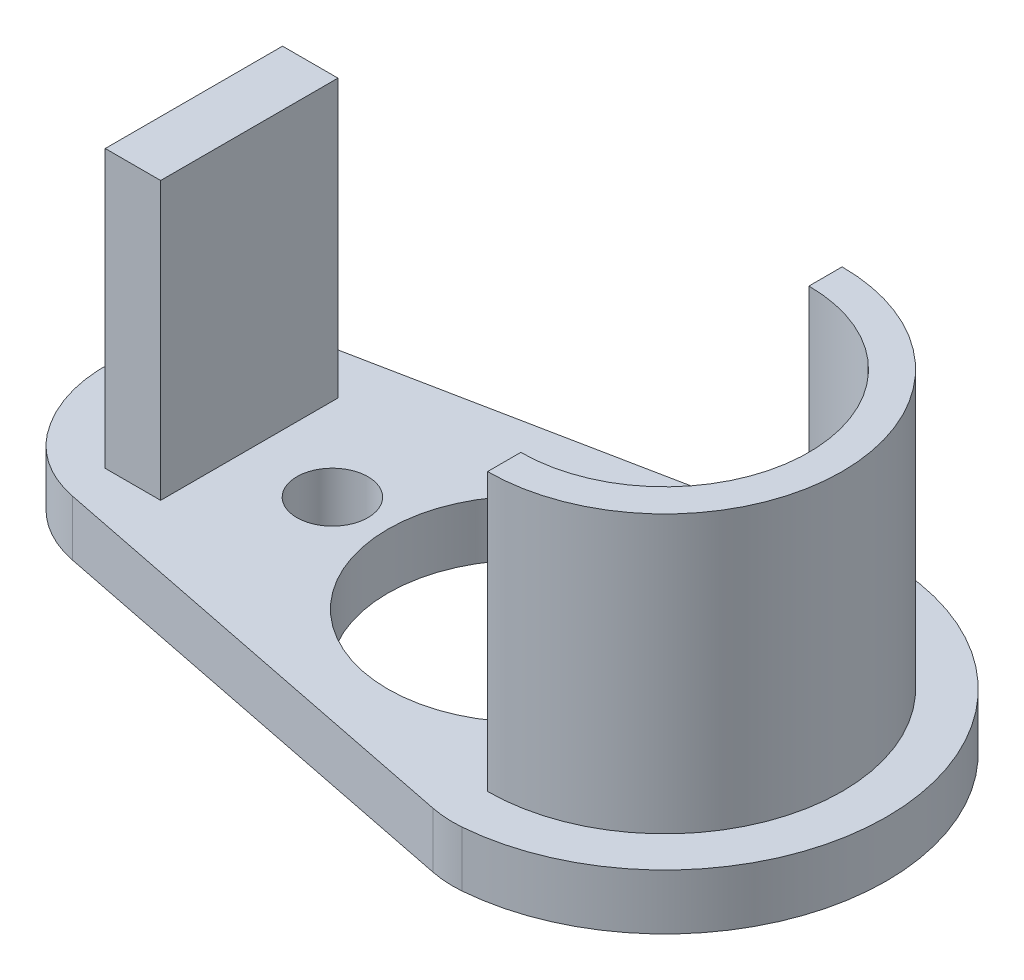
from build123d import *

# Parameters (mm, degrees)
SKETCH1_R           = 1.25
SKETCH1_R_2         = 0.3207
BOSS_EXTRUDE1_DEPTH = 0.5
SKETCH1_24_W        = 0.5
SKETCH1_24_H        = 1.6
BOSS_EXTRUDE2_DEPTH = 3


with BuildPart() as part:
    # Sketch1 → Boss-Extrude1 (new body)
    with BuildSketch(Plane(origin=(0, 0, 0), x_dir=(1, 0, 0), z_dir=(0, 1, 0))):
        with BuildLine():
            ThreePointArc((0.1641009, 1.993256355), (0.024548565, 1.994973575), (-0.113883759, 1.977245221))
            Line((-0.113883759, 1.977245221), (-4.183235691, 1.164159973))
            ThreePointArc((-4.183235691, 1.164159973), (-4.514100231, 1.033532975), (-4.77830642, 0.795352694))
            ThreePointArc((-4.77830642, 0.795352694), (-5.05, 0), (-4.77830642, -0.795352694))
            ThreePointArc((-4.77830642, -0.795352694), (-4.514100231, -1.033532975), (-4.183235691, -1.164159973))
            Line((-4.183235691, -1.164159973), (-0.11388376, -1.977245221))
            ThreePointArc((-0.11388376, -1.977245221), (0.024548564, -1.994973575), (0.164100898, -1.993256355))
            ThreePointArc((0.164100898, -1.993256355), (2, -1e-09), (0.1641009, 1.993256355))
        make_face()
        with Locations((-1.25, 0)):
            Circle(SKETCH1_R, mode=Mode.SUBTRACT)
        with Locations((0.5, 0)):
            Circle(SKETCH1_R_2, mode=Mode.SUBTRACT)
        with Locations((-3, 0)):
            Circle(SKETCH1_R_2, mode=Mode.SUBTRACT)
    extrude(amount=BOSS_EXTRUDE1_DEPTH)

    # Sketch1<24> → Boss-Extrude2 (add)
    with BuildSketch(Plane(origin=(0, 0, 0), x_dir=(1, 0, 0), z_dir=(0, 1, 0))):
        with BuildLine():
            ThreePointArc((0, -1.6), (1.6, 0), (0, 1.6))
            Line((0, 1.6), (0, 1.3))
            ThreePointArc((0, 1.3), (1.3, 0), (0, -1.3))
            Line((0, -1.3), (0, -1.6))
        make_face()
        with Locations((-4, 0)):
            Rectangle(SKETCH1_24_W, SKETCH1_24_H)
    extrude(amount=BOSS_EXTRUDE2_DEPTH)


solid = part.part
